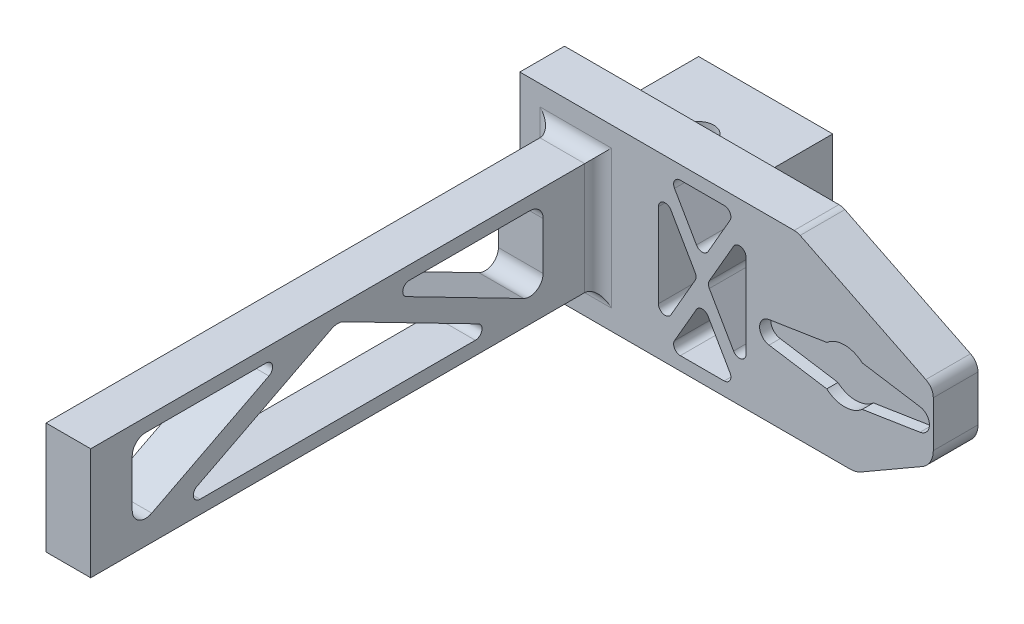
from build123d import *

# Parameters (mm, degrees)
SKETCH3_W             = 42.5
SKETCH3_H             = 15
BOSS_EXTRUDE1_DEPTH   = 10
CUT_EXTRUDE1_DEPTH    = 2.5
SKETCH11_W            = 42.5
SKETCH11_H            = 10
BOSS_EXTRUDE5_DEPTH   = 10
SKETCH14_W            = 42.5
SKETCH14_H            = 10
BOSS_EXTRUDE7_DEPTH   = 15
SKETCH20_W            = 10
SKETCH20_H            = 40
BOSS_EXTRUDE10_DEPTH  = 50
SKETCH21_W            = 10
SKETCH21_H            = 25
BOSS_EXTRUDE11_DEPTH  = 113.5
SKETCH22_W            = 30
SKETCH22_H            = 6
BOSS_EXTRUDE12_DEPTH  = 30
SKETCH23_W            = 30
SKETCH23_H            = 30
BOSS_EXTRUDE13_DEPTH  = 8.5
FILLET1_R             = 3
CHAMFER1_SIZE         = 15
CHAMFER1_SIZE2        = 30.41699103
FILLET2_R             = 3
CHAMFER2_SIZE         = 10
CHAMFER2_SIZE2        = 17.320508076
FILLET3_R             = 5
CUT_EXTRUDE2_DEPTH    = 144.583262507
FILLET4_R             = 3
FILLET5_R             = 1.5
M8_TAPPED_HOLE1_D     = 6.8
M8_TAPPED_HOLE1_DEPTH = 22.25
M8_TAPPED_HOLE1_TIP   = 2.042926105
CUT_EXTRUDE3_DEPTH    = 141.312152004
FILLET6_R             = 1.5


with BuildPart() as part:
    # Sketch3 → Boss-Extrude1 (new body)
    with BuildSketch(Plane.XY):
        with Locations((-1.388845539, 0.05888455)):
            Rectangle(SKETCH3_W, SKETCH3_H)
    extrude(amount=-BOSS_EXTRUDE1_DEPTH)

    # Sketch2 → Cut-Extrude1 (cut)
    with BuildSketch(Plane.XY):
        with BuildLine():
            Line((-16.888114198, 2.469689731), (-3.968626967, 4.5))
            ThreePointArc((-3.968626967, 4.5), (0, 6), (3.968626967, 4.5))
            Line((3.968626967, 4.5), (16.888114198, 2.469689731))
            ThreePointArc((16.888114198, 2.469689731), (19, 0), (16.888114198, -2.469689731))
            Line((16.888114198, -2.469689731), (3.968626967, -4.5))
            ThreePointArc((3.968626967, -4.5), (0, -6), (-3.968626967, -4.5))
            Line((-3.968626967, -4.5), (-16.888114198, -2.469689731))
            ThreePointArc((-16.888114198, -2.469689731), (-19, 0), (-16.888114198, 2.469689731))
        make_face()
    extrude(amount=-CUT_EXTRUDE1_DEPTH, mode=Mode.SUBTRACT)

    # Sketch11 → Boss-Extrude5 (add)
    with BuildSketch(Plane.XZ.offset(7.44111545)):
        with Locations((-1.388845539, -5)):
            Rectangle(SKETCH11_W, SKETCH11_H)
    extrude(amount=BOSS_EXTRUDE5_DEPTH)

    # Sketch14 → Boss-Extrude7 (add)
    with BuildSketch(Plane(origin=(0, 7.55888455, 0), x_dir=(1, 0, 0), z_dir=(0, 1, 0))):
        with Locations((-1.388845539, 5)):
            Rectangle(SKETCH14_W, SKETCH14_H)
    extrude(amount=BOSS_EXTRUDE7_DEPTH)

    # Sketch20 → Boss-Extrude10 (add)
    with BuildSketch(Plane.ZY.offset(22.638845539)):
        with Locations((-5, 2.55888455)):
            Rectangle(SKETCH20_W, SKETCH20_H)
    extrude(amount=BOSS_EXTRUDE10_DEPTH)

    # Sketch21 → Boss-Extrude11 (add)
    with BuildSketch(Plane.XY):
        with Locations((-60.138845539, 2.55888455)):
            Rectangle(SKETCH21_W, SKETCH21_H)
    extrude(amount=BOSS_EXTRUDE11_DEPTH)

    # Sketch22 → Boss-Extrude12 (add)
    with BuildSketch(Plane(origin=(0, 0, -10), x_dir=(-1, 0, 0), z_dir=(0, 0, -1))):
        with Locations((57.638845539, 2.55888455)):
            Rectangle(SKETCH22_W, SKETCH22_H)
    extrude(amount=BOSS_EXTRUDE12_DEPTH)

    # Sketch23 → Boss-Extrude13 (add)
    with BuildSketch(Plane.XZ.offset(0.44111545)):
        with Locations((-57.638845539, -25)):
            Rectangle(SKETCH23_W, SKETCH23_H)
    extrude(amount=BOSS_EXTRUDE13_DEPTH)

    # Fillet1
    fillet1_edges = [part.edges().sort_by_distance(p)[0] for p in [
        (-65.138845539, 2.55888455, 0),
        (-60.138845539, -9.94111545, 0),
        (-55.138845539, 2.55888455, 0),
        (-60.138845539, 15.05888455, 0),
    ]]
    fillet(fillet1_edges, radius=FILLET1_R)

    # Chamfer1
    chamfer1_edges = [part.edges().sort_by_distance(p)[0] for p in [
        (19.861154461, 22.55888455, -5),
    ]]
    chamfer1_side = [part.faces().sort_by_distance(p)[0] for p in [
        (19.861154461, 2.55888455, -5),
    ]]
    chamfer(chamfer1_edges, length=CHAMFER1_SIZE, length2=CHAMFER1_SIZE2, reference=chamfer1_side[0])

    # Fillet2
    fillet2_edges = [part.edges().sort_by_distance(p)[0] for p in [
        (-10.555836569, 22.55888455, -5),
        (19.861154461, 7.55888455, -5),
    ]]
    fillet(fillet2_edges, radius=FILLET2_R)

    # Chamfer2
    chamfer2_edges = [part.edges().sort_by_distance(p)[0] for p in [
        (19.861154461, -17.44111545, -5),
    ]]
    chamfer2_side = [part.faces().sort_by_distance(p)[0] for p in [
        (19.861154461, -5.873875391, -5),
    ]]
    chamfer(chamfer2_edges, length=CHAMFER2_SIZE, length2=CHAMFER2_SIZE2, reference=chamfer2_side[0])

    # Fillet3
    fillet3_edges = [part.edges().sort_by_distance(p)[0] for p in [
        (2.540646385, -17.44111545, -5),
        (19.861154461, -7.44111545, -5),
    ]]
    fillet(fillet3_edges, radius=FILLET3_R)

    # Sketch24 → Cut-Extrude2 (cut, through all)
    with BuildSketch(Plane.ZY.offset(65.138845539)):
        Polygon((58.25, -6.94111545), (95.25, -6.94111545), (58.25, 12.05888455), (21.25, -6.94111545), align=None)
        Polygon((48.39896268, 12.05888455), (12.290027833, -6.483541453), (12.290027833, 12.05888455), align=None)
        Polygon((68.10103732, 12.05888455), (104.209972167, 12.05888455), (104.209972167, -6.483541453), align=None)
    extrude(amount=-CUT_EXTRUDE2_DEPTH, mode=Mode.SUBTRACT)

    # Fillet4
    fillet4_edges = [part.edges().sort_by_distance(p)[0] for p in [
        (-60.138845539, -6.483541453, 104.209972167),
        (-60.138845539, 12.05888455, 104.209972167),
        (-60.138845539, 12.05888455, 12.290027833),
        (-60.138845539, -6.483541453, 12.290027833),
        (-60.138845539, 12.05888455, 58.25),
    ]]
    fillet(fillet4_edges, radius=FILLET4_R)

    # Fillet5
    fillet5_edges = [part.edges().sort_by_distance(p)[0] for p in [
        (-60.138845539, 12.05888455, 68.10103732),
        (-60.138845539, 12.05888455, 48.39896268),
        (-60.138845539, -6.94111545, 21.25),
        (-60.138845539, -6.94111545, 95.25),
    ]]
    fillet(fillet5_edges, radius=FILLET5_R)

    # M8 Tapped Hole1
    with Locations(Plane(origin=(0, 5.55888455, 0), x_dir=(1, 0, 0), z_dir=(0, 1, 0))):
        with Locations((-57.638845539, 25)):
            Hole(M8_TAPPED_HOLE1_D / 2, depth=M8_TAPPED_HOLE1_DEPTH)
            with Locations((0, 0, -(M8_TAPPED_HOLE1_DEPTH + M8_TAPPED_HOLE1_TIP / 2))):  # 118° drill point
                Cone(0, M8_TAPPED_HOLE1_D / 2, M8_TAPPED_HOLE1_TIP, mode=Mode.SUBTRACT)

    # Sketch32 → Cut-Extrude3 (cut, through all)
    with BuildSketch(Plane(origin=(-42.638845539, 5.55888455, -10), x_dir=(1, 0, 0), z_dir=(0, 0, 1))):
        Polygon((10.809559843, 14), (3.309559843, 14), (10.809559843, 1.002474929), (18.309559843, 14), align=None)
        Polygon((1, 12), (9.65549398, -3), (1, -18), (1, -3), align=None)
        Polygon((10.809559843, -7.002474929), (18.309559843, -20), (10.809559843, -20), (3.309559843, -20), align=None)
        Polygon((20.619119687, -18), (20.619119687, -3), (20.619119687, 12), (11.963625707, -3), align=None)
    extrude(amount=CUT_EXTRUDE3_DEPTH, mode=Mode.SUBTRACT)

    # Fillet6
    fillet6_edges = [part.edges().sort_by_distance(p)[0] for p in [
        (-41.638845539, 17.55888455, -5),
        (-41.638845539, -12.44111545, -5),
        (-32.98335156, 2.55888455, -5),
        (-22.019725852, 17.55888455, -5),
        (-30.675219832, 2.55888455, -5),
        (-22.019725852, -12.44111545, -5),
        (-24.329285696, -14.44111545, -5),
        (-31.829285696, -1.44359038, -5),
        (-39.329285696, -14.44111545, -5),
        (-24.329285696, 19.55888455, -5),
        (-39.329285696, 19.55888455, -5),
        (-31.829285696, 6.561359479, -5),
    ]]
    fillet(fillet6_edges, radius=FILLET6_R)


solid = part.part
